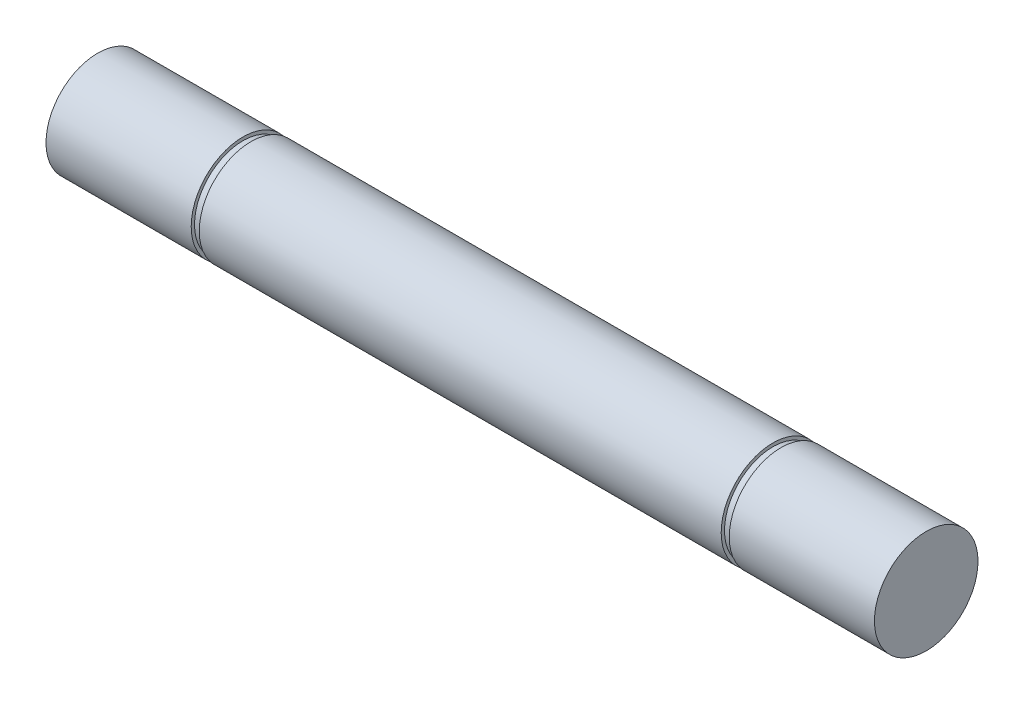
from build123d import *

# Parameters (mm, degrees)
SKETCH1_R           = 6.35
BOSS_EXTRUDE1_DEPTH = 101.6
CUT_EXTRUDE1_START  = 0.9906
SKETCH2_R           = 6.35
SKETCH2_R_2         = 5.9436
CUT_EXTRUDE1_DEPTH  = 0.9906


with BuildPart() as part:
    # Sketch1 → Boss-Extrude1 (new body)
    with BuildSketch(Plane(origin=(0, 0, 0), x_dir=(0, 0, -1), z_dir=(1, 0, 0))):
        Circle(SKETCH1_R)
    extrude(amount=BOSS_EXTRUDE1_DEPTH)

    # Sketch2 → Cut-Extrude1 (cut)
    with BuildSketch(Plane.ZY.offset(-18.796).offset(CUT_EXTRUDE1_START)):
        Circle(SKETCH2_R)
        Circle(SKETCH2_R_2, mode=Mode.SUBTRACT)
    cut_extrude1 = extrude(amount=-CUT_EXTRUDE1_DEPTH, mode=Mode.SUBTRACT)

    # Mirror1: Cut-Extrude1 across plane
    add(cut_extrude1.mirror(Plane.ZY.offset(-50.8)), mode=Mode.SUBTRACT)


solid = part.part
